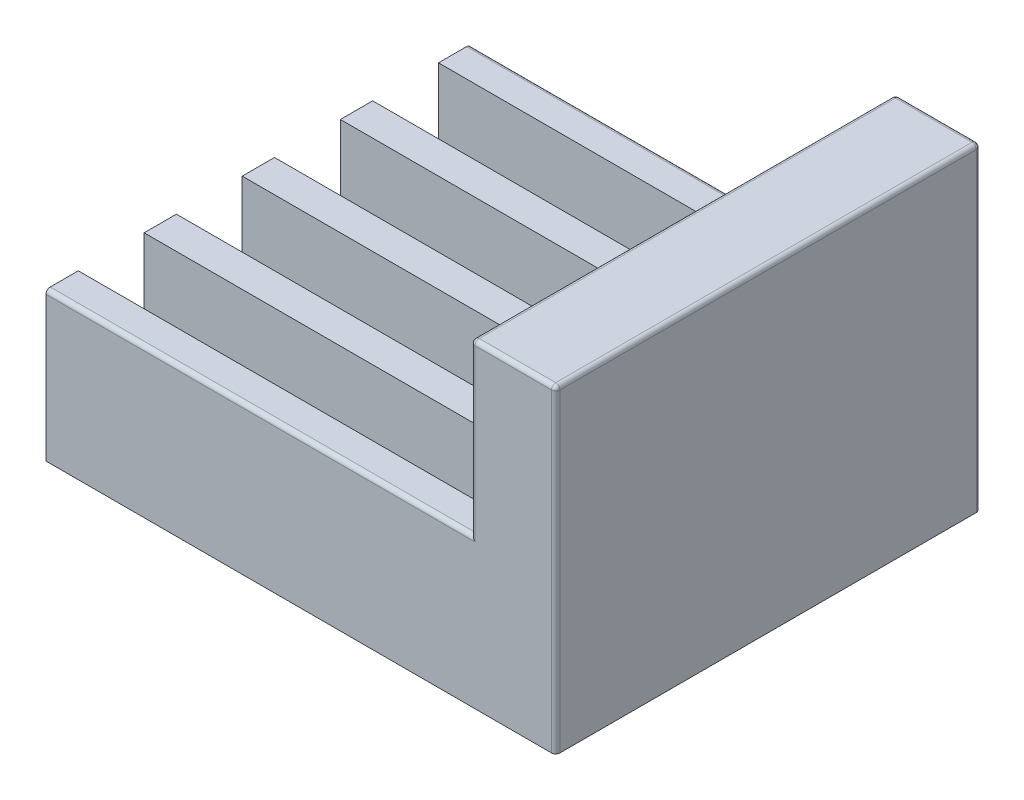
from build123d import *

# Parameters (mm, degrees)
SKETCH1_W           = 120
SKETCH1_H           = 100
BOSS_EXTRUDE1_DEPTH = 75
SKETCH2_W           = 100
SKETCH2_H           = 100
CUT_EXTRUDE1_DEPTH  = 40
SKETCH6_W           = 15.5
SKETCH6_H           = 15.5
CUT_EXTRUDE4_DEPTH  = 100
SKETCH8_W           = 19.1
SKETCH8_H           = 10
CUT_EXTRUDE5_DEPTH  = 100
SKETCH6_3_R         = 5.95
CUT_EXTRUDE6_DEPTH  = 111
FILLET1_R           = 1
CHAMFER1_SIZE       = 1
FILLET2_R           = 0.5


with BuildPart() as part:
    # Sketch1 → Boss-Extrude1 (new body)
    with BuildSketch(Plane(origin=(0, 0, 0), x_dir=(1, 0, 0), z_dir=(0, 1, 0))):
        with Locations((-3.53539823, -7.581858407)):
            Rectangle(SKETCH1_W, SKETCH1_H)
    extrude(amount=BOSS_EXTRUDE1_DEPTH)

    # Sketch2 → Cut-Extrude1 (cut)
    with BuildSketch(Plane(origin=(0, 75, 0), x_dir=(1, 0, 0), z_dir=(0, 1, 0))):
        with Locations((-13.53539823, -7.581858407)):
            Rectangle(SKETCH2_W, SKETCH2_H)
    extrude(amount=-CUT_EXTRUDE1_DEPTH, mode=Mode.SUBTRACT)

    # Sketch6 → Cut-Extrude4 (cut)
    with BuildSketch(Plane.ZY.offset(63.53539823)):
        with Locations((-27.068141593, 27.25)):
            Rectangle(SKETCH6_W, SKETCH6_H)
        with Locations((-3.968141593, 27.25)):
            Rectangle(SKETCH6_W, SKETCH6_H)
        with Locations((19.131858407, 27.25)):
            Rectangle(SKETCH6_W, SKETCH6_H)
        with Locations((42.231858407, 27.25)):
            Rectangle(SKETCH6_W, SKETCH6_H)
    extrude(amount=-CUT_EXTRUDE4_DEPTH, mode=Mode.SUBTRACT)

    # Sketch8 → Cut-Extrude5 (cut)
    with BuildSketch(Plane.ZY.offset(63.53539823)):
        with Locations((-27.068141593, 14.5)):
            Rectangle(SKETCH8_W, SKETCH8_H)
        with Locations((-3.968141593, 14.5)):
            Rectangle(SKETCH8_W, SKETCH8_H)
        with Locations((42.231858407, 14.5)):
            Rectangle(SKETCH8_W, SKETCH8_H)
        with Locations((19.131858407, 14.5)):
            Rectangle(SKETCH8_W, SKETCH8_H)
    extrude(amount=-CUT_EXTRUDE5_DEPTH, mode=Mode.SUBTRACT)

    # Sketch6<3> → Cut-Extrude6 (cut)
    with BuildSketch(Plane.ZY.offset(63.53539823)):
        with Locations((-27.068141593, 27.25)):
            Circle(SKETCH6_3_R)
        with Locations((-3.968141593, 27.25)):
            Circle(SKETCH6_3_R)
        with Locations((42.231858407, 27.25)):
            Circle(SKETCH6_3_R)
        with Locations((19.131858407, 27.25)):
            Circle(SKETCH6_3_R)
    extrude(amount=-CUT_EXTRUDE6_DEPTH, mode=Mode.SUBTRACT)

    # Fillet1
    fillet1_edges = [part.edges().sort_by_distance(p)[0] for p in [
        (-13.53539823, 35, -42.418141593),
        (-13.53539823, 35, 57.581858407),
        (36.46460177, 55, -42.418141593),
        (36.46460177, 55, 57.581858407),
        (46.46460177, 75, 57.581858407),
        (36.46460177, 75, 7.581858407),
        (46.46460177, 75, -42.418141593),
        (56.46460177, 75, 7.581858407),
        (56.46460177, 37.5, 57.581858407),
        (56.46460177, 37.5, -42.418141593),
    ]]
    fillet(fillet1_edges, radius=FILLET1_R)

    # Chamfer1
    chamfer1_edges = [part.edges().sort_by_distance(p)[0] for p in [
        (36.46460177, 27.25, 36.281858407),
        (36.46460177, 27.25, 13.181858407),
        (36.46460177, 27.25, -9.918141593),
        (36.46460177, 27.25, -33.018141593),
    ]]
    chamfer(chamfer1_edges, length=CHAMFER1_SIZE)

    # Fillet2
    fillet2_edges = [part.edges().sort_by_distance(p)[0] for p in [
        (47.46460177, 27.25, 36.281858407),
        (47.46460177, 27.25, 13.181858407),
        (47.46460177, 27.25, -9.918141593),
        (47.46460177, 27.25, -33.018141593),
    ]]
    fillet(fillet2_edges, radius=FILLET2_R)


solid = part.part
